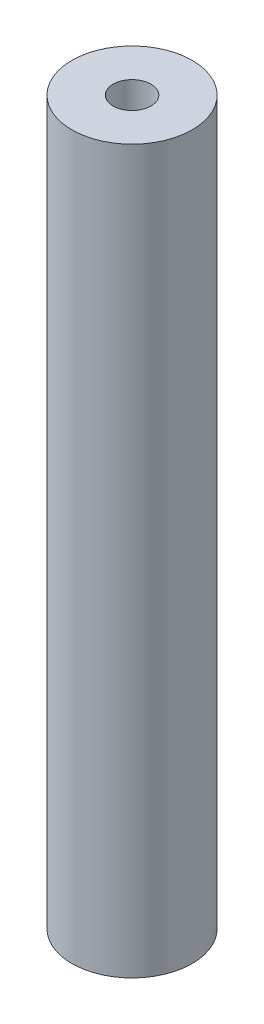
from build123d import *

# Parameters (mm, degrees)
SKETCH1_R           = 6.35
BOSS_EXTRUDE1_DEPTH = 76.2
SKETCH2_R           = 2.000000064
CUT_EXTRUDE1_DEPTH  = 6.99999997
CUT_EXTRUDE2_START  = -6.99999997
SKETCH3_R           = 2
CUT_EXTRUDE2_DEPTH  = 6.99999997


with BuildPart() as part:
    # Sketch1 → Boss-Extrude1 (new body)
    with BuildSketch(Plane(origin=(0, 0, 0), x_dir=(1, 0, 0), z_dir=(0, 1, 0))):
        with Locations(Location((0, 0, 0), (0, 0, 90))):
            Circle(SKETCH1_R)
    extrude(amount=BOSS_EXTRUDE1_DEPTH)

    # Sketch2 → Cut-Extrude1 (cut)
    with BuildSketch(Plane.XZ):
        with Locations(Location((0, 0, 0), (0, 0, 270))):
            Circle(SKETCH2_R)
    extrude(amount=-CUT_EXTRUDE1_DEPTH, mode=Mode.SUBTRACT)

    # Sketch3 → Cut-Extrude2 (cut)
    with BuildSketch(Plane(origin=(0, 76.2, 0), x_dir=(1, 0, 0), z_dir=(0, 1, 0)).offset(CUT_EXTRUDE2_START)):
        with Locations(Location((0, 0, 0), (0, 0, 90))):
            Circle(SKETCH3_R)
    extrude(amount=CUT_EXTRUDE2_DEPTH, mode=Mode.SUBTRACT)


solid = part.part
